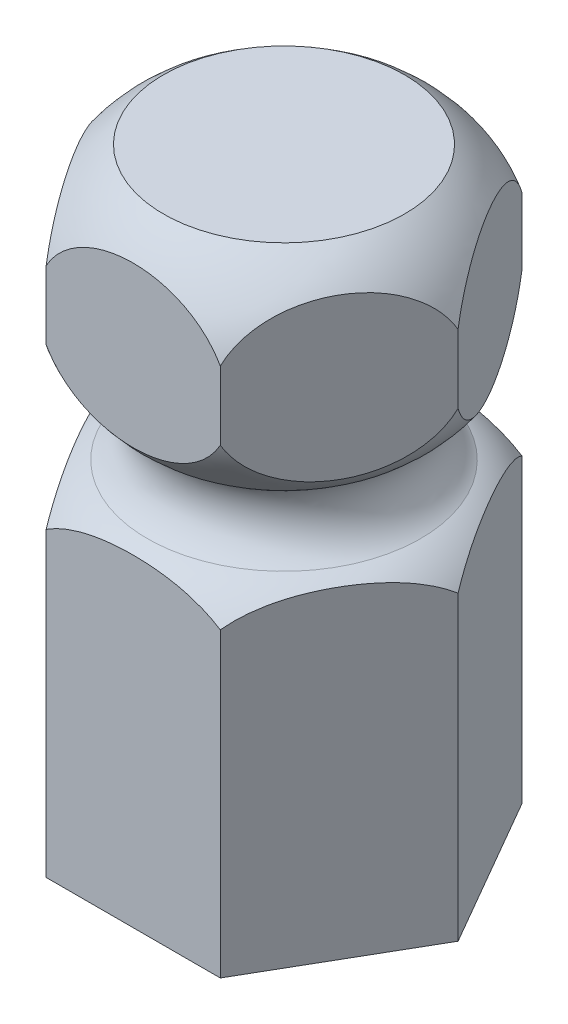
from build123d import *

# Parameters (mm, degrees)
BOSS_EXTRUDE1_DEPTH = 10


with BuildPart() as part:
    # Sketch1 → Boss-Extrude1 (new body)
    with BuildSketch(Plane(origin=(0, 0, 0), x_dir=(1, 0, 0), z_dir=(0, 1, 0))):
        Polygon((2.886751346, 0), (1.443375673, 2.5), (-1.443375673, 2.5), (-2.886751346, 0), (-1.443375673, -2.5), (1.443375673, -2.5), align=None)
    extrude(amount=BOSS_EXTRUDE1_DEPTH)

    # Sketch3 → Cut-Revolve1 (revolve, cut)
    with BuildSketch(Plane.XY, mode=Mode.PRIVATE) as cut_revolve1_sk:
        with BuildLine():
            Line((-2, 10), (-2, 10.901570298))
            Line((-2, 10.901570298), (-4.378417403, 10.901570298))
            Line((-4.378417403, 10.901570298), (-4.378417403, 5))
            Line((-4.378417403, 5), (-2.886751346, 5))
            ThreePointArc((-2.886751346, 5), (-2.607836376, 5.276622353), (-2.266701974, 5.471406351))
            ThreePointArc((-2.266701974, 5.471406351), (-1.950264944, 5.90495326), (-2, 6.439389168))
            ThreePointArc((-2, 6.439389168), (-2.964233791, 8.219694584), (-2, 10))
        make_face()
    revolve(cut_revolve1_sk.sketch.rotate(Axis((0, -0.795078515, 0), (0, 1, 0)), 270), axis=Axis((0, -0.795078515, 0), (0, 1, 0)), mode=Mode.SUBTRACT)


solid = part.part
